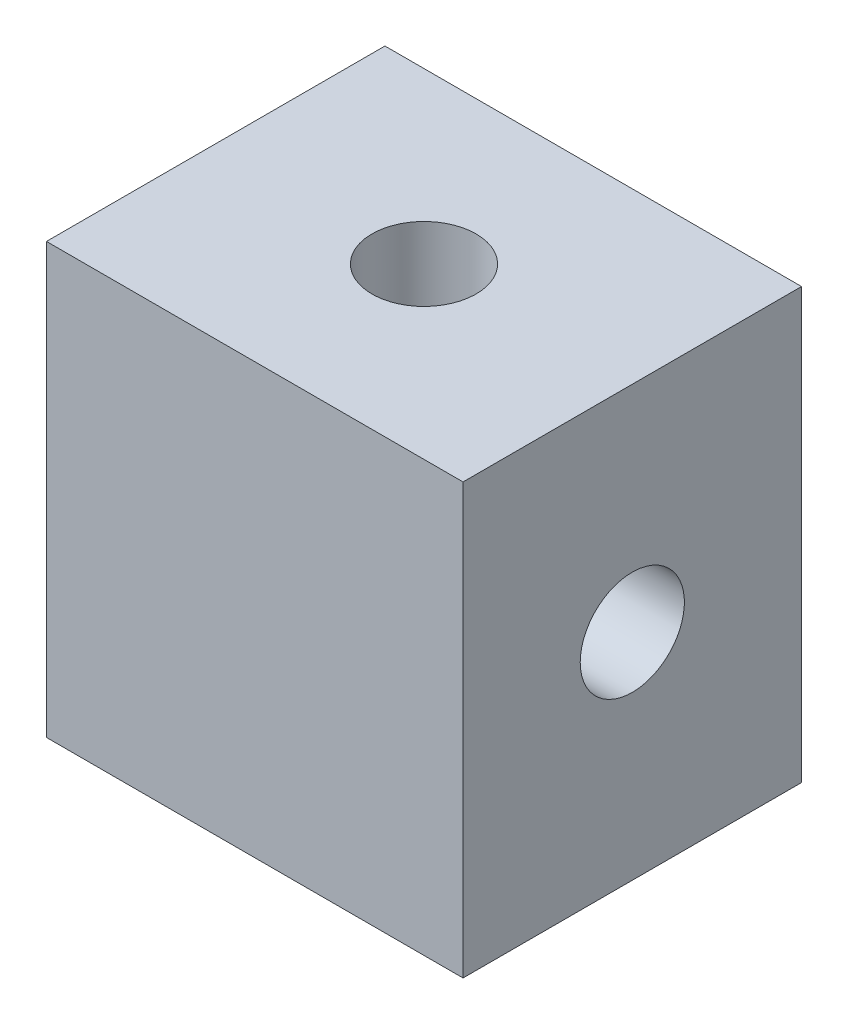
from build123d import *

# Parameters (mm, degrees)
SK_BLOCK_W       = 32
SK_BLOCK_H       = 33
BLOCK_DEPTH      = 26
SK_PITCH_BORE_R  = 4
PITCH_BORE_DEPTH = 40
SK_ROLL_BORE_R   = 4
ROLL_BORE_DEPTH  = 40


with BuildPart() as part:
    # SK_Block → Block (new body)
    with BuildSketch(Plane.XY.offset(-13)):
        Rectangle(SK_BLOCK_W, SK_BLOCK_H)
    extrude(amount=BLOCK_DEPTH)

    # SK_Pitch_Bore → Pitch_Bore (cut)
    with BuildSketch(Plane(origin=(0, -20, 0), x_dir=(1, 0, 0), z_dir=(0, 1, 0))):
        Circle(SK_PITCH_BORE_R)
    extrude(amount=PITCH_BORE_DEPTH, mode=Mode.SUBTRACT)

    # SK_Roll_Bore → Roll_Bore (cut)
    with BuildSketch(Plane(origin=(-20, 0, 0), x_dir=(0, 0, -1), z_dir=(1, 0, 0))):
        Circle(SK_ROLL_BORE_R)
    extrude(amount=ROLL_BORE_DEPTH, mode=Mode.SUBTRACT)


solid = part.part
